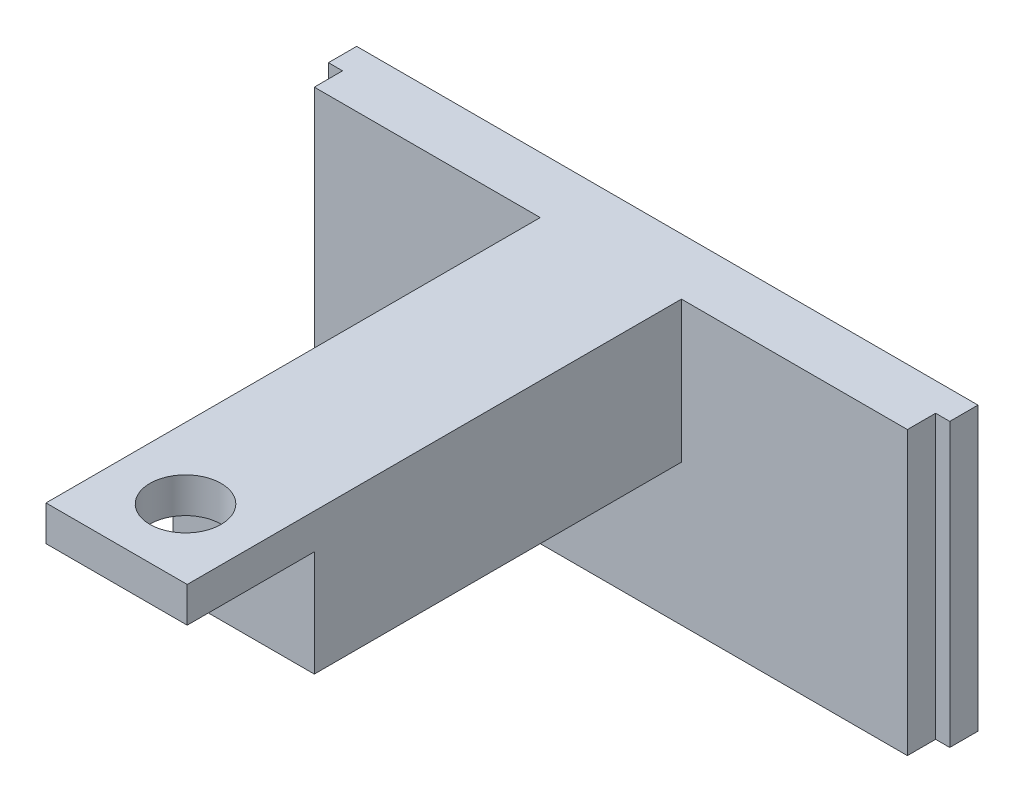
from build123d import *

# Parameters (mm, degrees)
IZIM1_W                     = 44
IZIM1_H                     = 20
Y_KSEKLIK_EKSTR_ZYON1_DEPTH = 2
IZIM2_W                     = 42
IZIM2_H                     = 20
Y_KSEKLIK_EKSTR_ZYON2_DEPTH = 2
IZIM3_W                     = 10
IZIM3_H                     = 10
Y_KSEKLIK_EKSTR_ZYON3_DEPTH = 35
IZIM4_R                     = 2.52
KES_EKSTR_ZYON1_DEPTH       = 11
IZIM5_W                     = 10
IZIM5_H                     = 7.5
KES_EKSTR_ZYON2_DEPTH       = 9


with BuildPart() as part:
    # Çizim1 → Yükseklik-Ekstrüzyon1 (new body)
    with BuildSketch(Plane.XY):
        Rectangle(IZIM1_W, IZIM1_H)
    extrude(amount=Y_KSEKLIK_EKSTR_ZYON1_DEPTH)

    # Çizim2 → Yükseklik-Ekstrüzyon2 (add)
    with BuildSketch(Plane.XY.offset(2)):
        Rectangle(IZIM2_W, IZIM2_H)
    extrude(amount=Y_KSEKLIK_EKSTR_ZYON2_DEPTH)

    # Çizim3 → Yükseklik-Ekstrüzyon3 (add)
    with BuildSketch(Plane.XY.offset(4)):
        with Locations((0, 5)):
            Rectangle(IZIM3_W, IZIM3_H)
    extrude(amount=Y_KSEKLIK_EKSTR_ZYON3_DEPTH)

    # Çizim4 → Kes-Ekstrüzyon1 (cut)
    with BuildSketch(Plane(origin=(0, 10, 0), x_dir=(1, 0, 0), z_dir=(0, 1, 0))):
        with Locations(Location((0, -34.12, 0), (0, 0, 270))):
            Circle(IZIM4_R)
    extrude(amount=-KES_EKSTR_ZYON1_DEPTH, mode=Mode.SUBTRACT)

    # Çizim5 → Kes-Ekstrüzyon2 (cut)
    with BuildSketch(Plane.XY.offset(39)):
        with Locations((0, 3.75)):
            Rectangle(IZIM5_W, IZIM5_H)
    extrude(amount=-KES_EKSTR_ZYON2_DEPTH, mode=Mode.SUBTRACT)


solid = part.part
